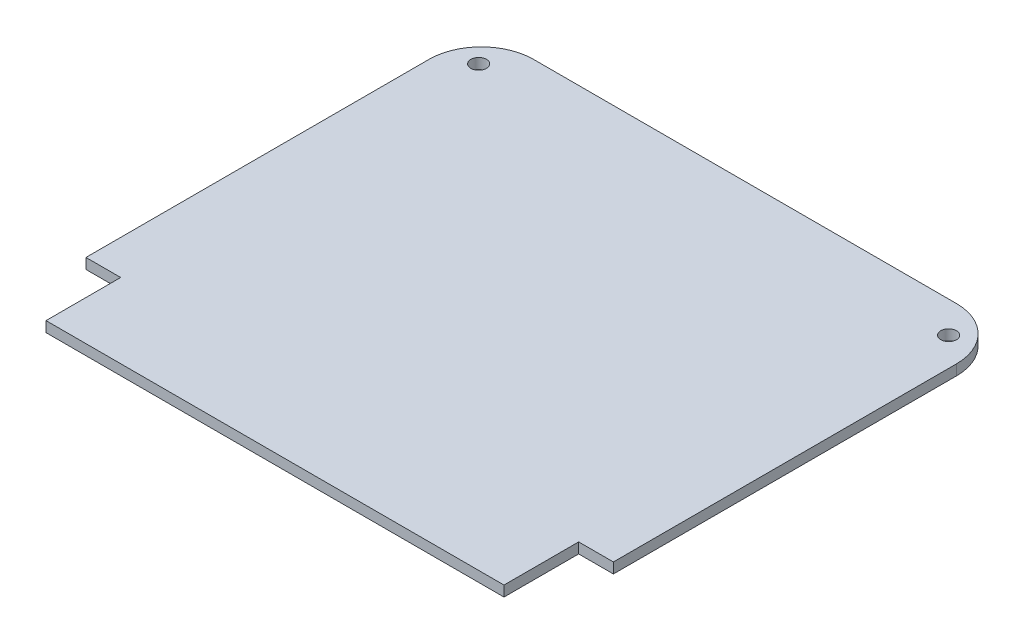
from build123d import *

# Parameters (mm, degrees)
EXTRUDE_1_DEPTH     = 2
SKETCH_3_R          = 1.5
CUT_EXTRUDE_1_DEPTH = 10


with BuildPart() as part:
    # 草图1 → 凸台-拉伸1 (new body)
    with BuildSketch(Plane(origin=(0, 0, 0), x_dir=(1, 0, 0), z_dir=(0, 1, 0))):
        with BuildLine():
            Line((0, -100.302122976), (0, -86.002122976))
            Line((0, -86.002122976), (6.65, -86.002122976))
            Line((6.65, -86.002122976), (6.65, -20.302122976))
            ThreePointArc((6.65, -20.302122976), (3.721067812, -13.231055164), (-3.35, -10.302122976))
            Line((-3.35, -10.302122976), (-84.35, -10.302122976))
            ThreePointArc((-84.35, -10.302122976), (-91.421067812, -13.231055164), (-94.35, -20.302122976))
            Line((-94.35, -20.302122976), (-94.35, -86.002122976))
            Line((-94.35, -86.002122976), (-87.7, -86.002122976))
            Line((-87.7, -86.002122976), (-87.7, -100.302122976))
            Line((-87.7, -100.302122976), (0, -100.302122976))
        make_face()
    extrude(amount=EXTRUDE_1_DEPTH)

    # 草图3 → 切除-拉伸1 (cut)
    with BuildSketch(Plane(origin=(0, 2, 0), x_dir=(1, 0, 0), z_dir=(0, 1, 0))):
        with Locations(Location((-88.85, -16.302122976, 0), (0, 0, 270))):
            Circle(SKETCH_3_R)
        with Locations(Location((1.15, -16.302122976, 0), (0, 0, 270))):
            Circle(SKETCH_3_R)
    extrude(amount=-CUT_EXTRUDE_1_DEPTH, mode=Mode.SUBTRACT)


solid = part.part
